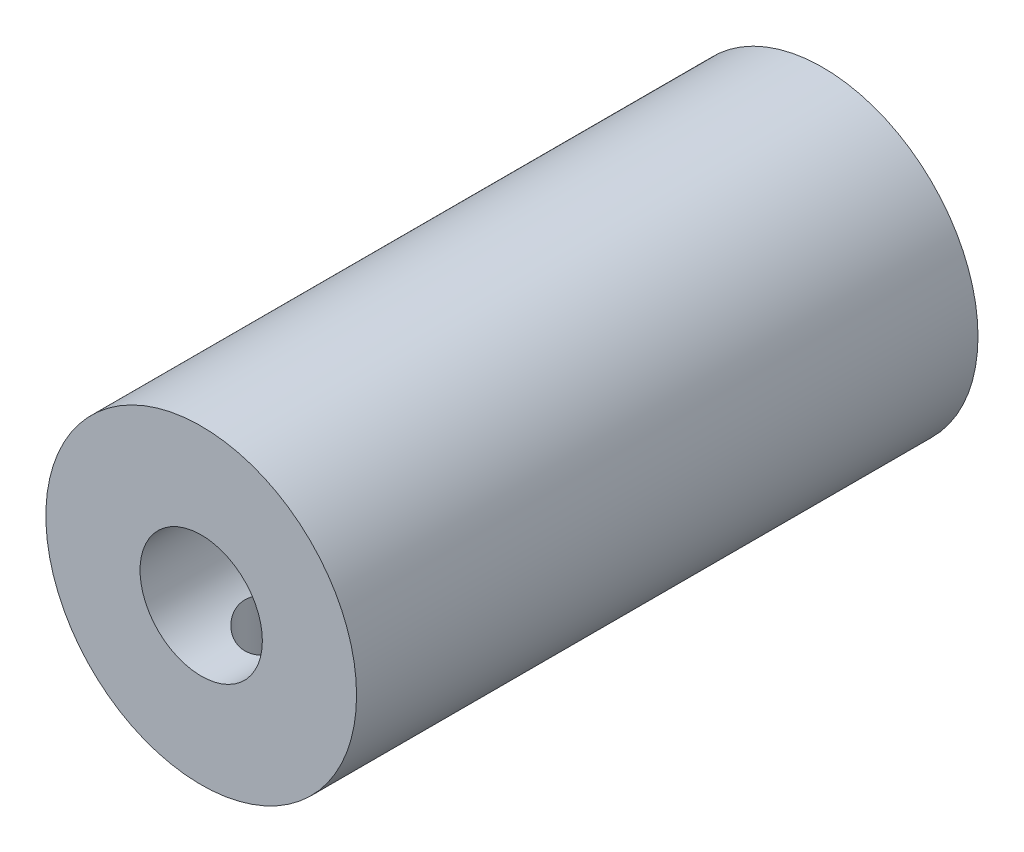
from build123d import *

# Parameters (mm, degrees)
SKETCH1_R               = 6.35
BOSS_EXTRUDE1_DEPTH     = 25.4
SKETCH2_R               = 2.5
CUT_EXTRUDE1_DEPTH      = 12.7
SKETCH3_R               = 3.175
CUT_EXTRUDE2_DEPTH      = 12.7
CUT_EXTRUDE4_REACH      = 28.941
CUT_EXTRUDE4_END_RADIUS = 6.35
SKETCH4_R               = 1.3890625


with BuildPart() as part:
    # Sketch1 → Boss-Extrude1 (new body)
    with BuildSketch(Plane.XY):
        Circle(SKETCH1_R)
    extrude(amount=BOSS_EXTRUDE1_DEPTH)

    # Sketch2 → Cut-Extrude1 (cut)
    with BuildSketch(Plane.XY.offset(25.4)):
        Circle(SKETCH2_R)
    extrude(amount=-CUT_EXTRUDE1_DEPTH, mode=Mode.SUBTRACT)

    # Sketch3 → Cut-Extrude2 (cut)
    with BuildSketch(Plane(origin=(0, 0, 0), x_dir=(-1, 0, 0), z_dir=(0, 0, -1))):
        Circle(SKETCH3_R)
    extrude(amount=-CUT_EXTRUDE2_DEPTH, mode=Mode.SUBTRACT)

    # Cut-Extrude4: up to this cylinder (the profile starts inside it)
    cut_extrude4_end = Plane(origin=(0, 0, 12.7), z_dir=(0, 0, -1)) * Cylinder(CUT_EXTRUDE4_END_RADIUS, 90.632, mode=Mode.PRIVATE)
    # Sketch4 → Cut-Extrude4 (cut, up to the surface)
    with BuildSketch(Plane(origin=(0, 0, 0), x_dir=(1, 0, 0), z_dir=(0, 1, 0)), mode=Mode.PRIVATE) as cut_extrude4_sk1:
        with Locations(Location((0, -22.225, 0), (0, 0, 270))):
            Circle(SKETCH4_R)
    cut_extrude4_tool1 = extrude(cut_extrude4_sk1.sketch, amount=-CUT_EXTRUDE4_REACH, mode=Mode.PRIVATE) & cut_extrude4_end
    add(cut_extrude4_tool1.solids().sort_by_distance((0, 0, 22.225))[0], mode=Mode.SUBTRACT)
    # Sketch4 → Cut-Extrude4 (cut, up to the surface)
    with BuildSketch(Plane(origin=(0, 0, 0), x_dir=(1, 0, 0), z_dir=(0, 1, 0)), mode=Mode.PRIVATE) as cut_extrude4_sk2:
        with Locations(Location((0, -3.175, 0), (0, 0, 270))):
            Circle(SKETCH4_R)
    cut_extrude4_tool2 = extrude(cut_extrude4_sk2.sketch, amount=-CUT_EXTRUDE4_REACH, mode=Mode.PRIVATE) & cut_extrude4_end
    add(cut_extrude4_tool2.solids().sort_by_distance((0, 0, 3.175))[0], mode=Mode.SUBTRACT)


solid = part.part
